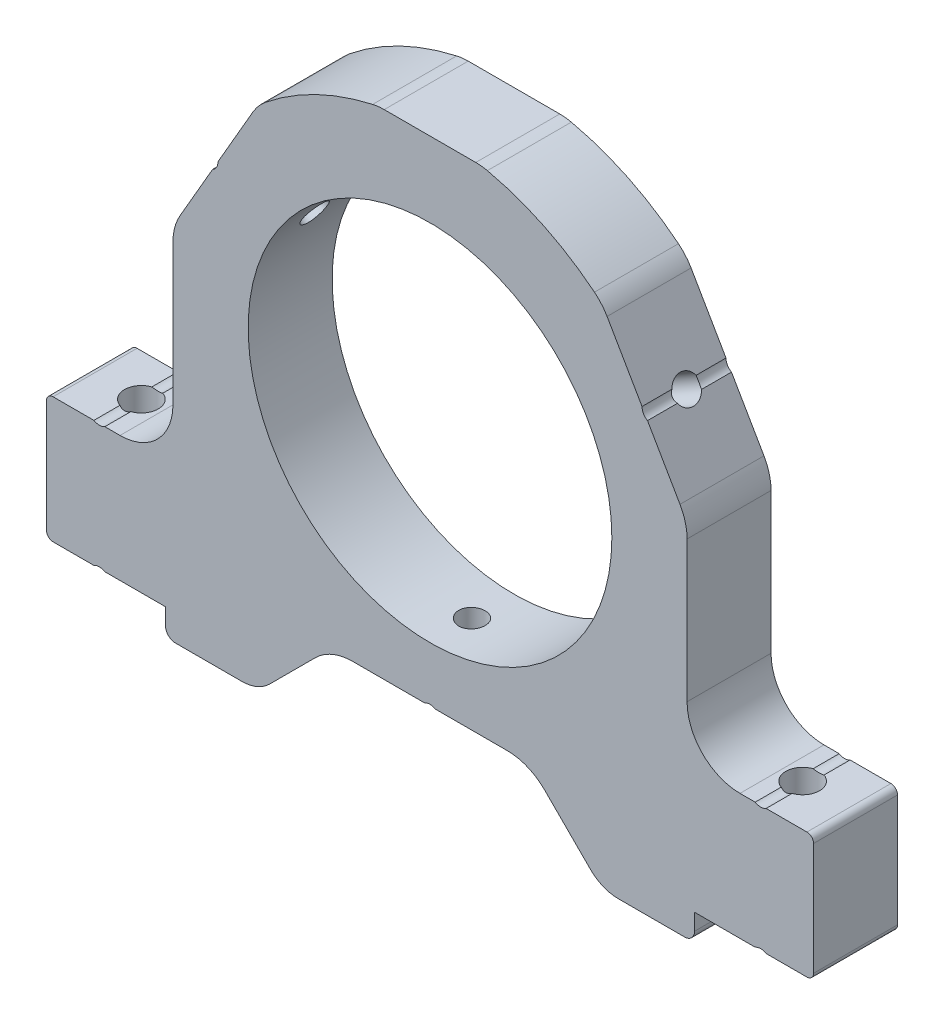
from build123d import *

# Parameters (mm, degrees)
SKETCH1_R           = 27.500000001
BOSS_EXTRUDE1_DEPTH = 12.7
SKETCH2_R           = 2.55
CUT_EXTRUDE1_DEPTH  = 406.309199291
SKETCH4_R           = 2
CUT_EXTRUDE2_DEPTH  = 15
SKETCH5_R           = 2
CUT_EXTRUDE3_DEPTH  = 15
SKETCH3_R           = 2
CUT_EXTRUDE4_DEPTH  = 15


with BuildPart() as part:
    # Sketch1 → Boss-Extrude1 (new body)
    with BuildSketch(Plane.XY):
        with BuildLine():
            Line((284.236473266, 94.417355971), (284.236473266, 77.41735597))
            ThreePointArc((284.236473266, 77.41735597), (284.529366484, 76.71024919), (285.236473265, 76.417355971))
            Line((285.236473265, 76.417355971), (291.410292076, 76.417355971))
            ThreePointArc((291.410292076, 76.417355971), (292.236473265, 76.642955971), (293.062654455, 76.417355971))
            Line((293.062654455, 76.417355971), (302.236473265, 76.417355971))
            Line((302.236473265, 76.417355971), (302.236473265, 73.91735597))
            ThreePointArc((302.236473265, 73.91735597), (302.675813094, 72.856695799), (303.736473265, 72.41735597))
            Line((303.736473265, 72.41735597), (313.751191892, 72.41735597))
            ThreePointArc((313.751191892, 72.41735597), (316.047292486, 72.874078775), (317.993832578, 74.174715283))
            Line((317.993832578, 74.174715283), (324.893327515, 81.074210219))
            ThreePointArc((324.893327515, 81.074210219), (327.488714305, 82.80839223), (330.550181764, 83.417355969))
            Line((330.550181764, 83.417355969), (341.410292075, 83.417355969))
            ThreePointArc((341.410292075, 83.417355969), (342.236473267, 83.642955969), (343.062654458, 83.417355968))
            Line((343.062654458, 83.417355968), (353.922764767, 83.417355968))
            ThreePointArc((353.922764767, 83.417355968), (356.984232225, 82.808392228), (359.579619016, 81.074210218))
            Line((359.579619016, 81.074210218), (366.479113952, 74.174715282))
            ThreePointArc((366.479113952, 74.174715282), (368.425654045, 72.874078773), (370.72175464, 72.417355968))
            Line((370.72175464, 72.417355968), (380.736473265, 72.417355968))
            ThreePointArc((380.736473265, 72.417355968), (381.797133436, 72.856695796), (382.236473264, 73.917355967))
            Line((382.236473264, 73.917355967), (382.236473264, 76.417355972))
            Line((382.236473264, 76.417355972), (391.410292073, 76.417355972))
            ThreePointArc((391.410292073, 76.417355972), (392.236473265, 76.642955972), (393.062654456, 76.417355971))
            Line((393.062654456, 76.417355971), (399.236473264, 76.417355971))
            ThreePointArc((399.236473264, 76.417355971), (399.943580044, 76.71024919), (400.236473263, 77.41735597))
            Line((400.236473263, 77.41735597), (400.236473263, 94.417355971))
            ThreePointArc((400.236473263, 94.417355971), (399.943580044, 95.124462751), (399.236473264, 95.41735597))
            Line((399.236473264, 95.41735597), (393.062654456, 95.41735597))
            ThreePointArc((393.062654456, 95.41735597), (392.236473265, 95.191755969), (391.410292073, 95.417355969))
            Line((391.410292073, 95.417355969), (389.110963045, 95.417355969))
            ThreePointArc((389.110963045, 95.417355969), (383.454108795, 97.760501719), (381.110963044, 103.417355969))
            Line((381.110963044, 103.417355969), (381.110963044, 124.734871013))
            ThreePointArc((381.110963044, 124.734871013), (380.838369654, 126.805423374), (380.039166274, 128.734871013))
            Line((380.039166274, 128.734871013), (375.125516501, 137.245562071))
            ThreePointArc((375.125516501, 137.245562071), (374.517050575, 137.848255971), (374.299335311, 138.676549871))
            Line((374.299335311, 138.676549871), (369.016145298, 147.8273034))
            ThreePointArc((369.016145298, 147.8273034), (368.165927768, 149.029042515), (367.109909002, 150.054650194))
            ThreePointArc((367.109909002, 150.054650194), (359.459956736, 154.89532039), (350.910948847, 157.873293146))
            ThreePointArc((350.910948847, 157.873293146), (350.040616408, 158.018692254), (349.159565162, 158.06735597))
            Line((349.159565162, 158.06735597), (335.313381368, 158.06735597))
            ThreePointArc((335.313381368, 158.06735597), (334.432330122, 158.018692254), (333.561997683, 157.873293146))
            ThreePointArc((333.561997683, 157.873293146), (325.012989794, 154.89532039), (317.363037528, 150.054650194))
            ThreePointArc((317.363037528, 150.054650194), (316.307018762, 149.029042515), (315.456801232, 147.8273034))
            Line((315.456801232, 147.8273034), (310.173611219, 138.676549871))
            ThreePointArc((310.173611219, 138.676549871), (309.955895955, 137.848255971), (309.34743003, 137.245562072))
            Line((309.34743003, 137.245562072), (304.433780256, 128.734871013))
            ThreePointArc((304.433780256, 128.734871013), (303.634576876, 126.805423374), (303.361983486, 124.734871013))
            Line((303.361983486, 124.734871013), (303.361983486, 103.417355969))
            ThreePointArc((303.361983486, 103.417355969), (301.018837735, 97.76050172), (295.361983486, 95.41735597))
            Line((295.361983486, 95.41735597), (293.062654455, 95.41735597))
            ThreePointArc((293.062654455, 95.41735597), (292.236473265, 95.19175597), (291.410292076, 95.41735597))
            Line((291.410292076, 95.41735597), (285.236473265, 95.41735597))
            ThreePointArc((285.236473265, 95.41735597), (284.529366484, 95.124462751), (284.236473266, 94.417355971))
        make_face()
        with Locations((342.236473265, 119.21105597)):
            Circle(SKETCH1_R, mode=Mode.SUBTRACT)
    extrude(amount=BOSS_EXTRUDE1_DEPTH)

    # Sketch2 → Cut-Extrude1 (cut, through all)
    with BuildSketch(Plane(origin=(0, 95.41735597, 0), x_dir=(1, 0, 0), z_dir=(0, 1, 0))):
        with Locations(Location((292.236473265, -6.35, 0), (0, 0, 288.904554562))):
            Circle(SKETCH2_R)
        with Locations(Location((392.236473265, -6.35, 0), (0, 0, 288.904554598))):
            Circle(SKETCH2_R)
    extrude(amount=-CUT_EXTRUDE1_DEPTH, mode=Mode.SUBTRACT)

    # Sketch4 → Cut-Extrude2 (cut)
    with BuildSketch(Plane(origin=(172.581500867, -99.639975983, 0), x_dir=(0, 0, 1), z_dir=(-0.8660254037844396, 0.49999999999999856, 0))):
        with Locations(Location((6.35, 274.358039516, 0), (0, 0, 270))):
            Circle(SKETCH4_R)
    extrude(amount=-CUT_EXTRUDE2_DEPTH, mode=Mode.SUBTRACT)

    # Sketch5 → Cut-Extrude3 (cut)
    with BuildSketch(Plane(origin=(340.773209032, 196.745503967, 0), x_dir=(0, 0, -1), z_dir=(0.8660254037844377, 0.5000000000000019, 0))):
        with Locations(Location((-6.35, -67.87843375, 0), (0, 0, 90))):
            Circle(SKETCH5_R)
    extrude(amount=-CUT_EXTRUDE3_DEPTH, mode=Mode.SUBTRACT)

    # Sketch3 → Cut-Extrude4 (cut)
    with BuildSketch(Plane.XZ.offset(-83.417355968)):
        with Locations(Location((342.236473266, 6.35, 0), (0, 0, 270))):
            Circle(SKETCH3_R)
    extrude(amount=-CUT_EXTRUDE4_DEPTH, mode=Mode.SUBTRACT)


solid = part.part
